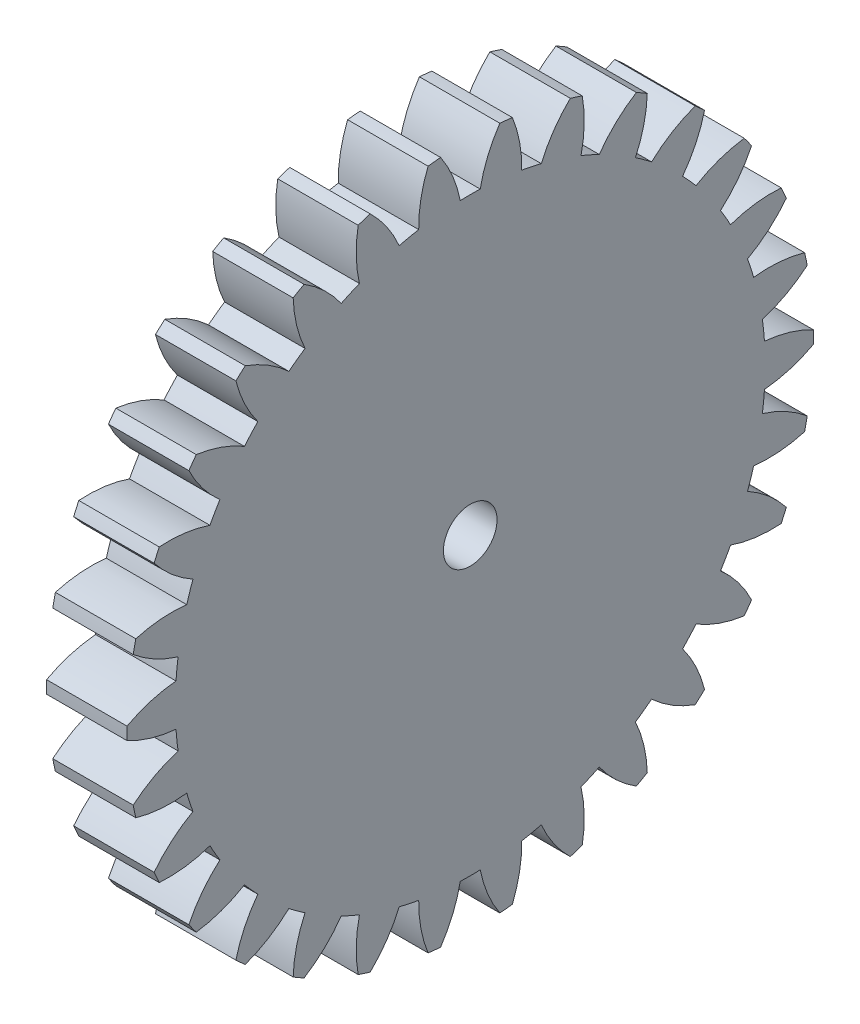
from build123d import *

# Parameters (mm, degrees)
BASPROSKE_W     = 3
BASPROSKE_H     = 12.8
TOOTHCUT_DEPTH  = 19.348841925
TEETHCUTS_COUNT = 30
TEETHCUTS_ANGLE = 348
BORSKE_R        = 1
BORE_DEPTH      = 50.0000508


with BuildPart() as part:
    # BasProSke → Base-Revolve (revolve)
    with BuildSketch(Plane(origin=(0, 0, 0), x_dir=(1, 0, 0), z_dir=(0, 1, 0)), mode=Mode.PRIVATE) as base_revolve_sk:
        with Locations((1.5, 6.4)):
            Rectangle(BASPROSKE_W, BASPROSKE_H)
    revolve(base_revolve_sk.sketch.rotate(Axis((-10, 0, 0), (1, 0, 0)), 180), axis=Axis((-10, 0, 0), (1, 0, 0)))

    # TooCutSke → ToothCut (cut, through all)
    with BuildSketch(Plane(origin=(0, 0, 0), x_dir=(0, 0, -1), z_dir=(1, 0, 0))):
        with BuildLine():
            ThreePointArc((0.37243947, 10.992692566), (0, 10.999), (-0.37243947, 10.992692566))
            ThreePointArc((-0.37243947, 10.992692566), (-0.655704499, 11.922595954), (-1.120515575, 12.776358245))
            ThreePointArc((-1.120515575, 12.776358245), (0, 12.8254), (1.120515575, 12.776358245))
            ThreePointArc((1.120515575, 12.776358245), (0.655704499, 11.922595954), (0.37243947, 10.992692566))
        make_face()
    toothcut = extrude(amount=TOOTHCUT_DEPTH, mode=Mode.SUBTRACT)

    # TeethCuts: ToothCut ×30 about axis
    teethcuts_axis = Axis((-10, 0, 0), (1, 0, 0))
    for i in range(1, TEETHCUTS_COUNT):
        add(toothcut.rotate(teethcuts_axis, i * TEETHCUTS_ANGLE / (TEETHCUTS_COUNT - 1)), mode=Mode.SUBTRACT)

    # BorSke → Bore (cut, symmetric)
    with BuildSketch(Plane(origin=(0, 0, 0), x_dir=(0, 0, -1), z_dir=(1, 0, 0))):
        with Locations(Location((0, 0, 0), (0, 0, 180))):
            Circle(BORSKE_R)
    extrude(amount=BORE_DEPTH, both=True, mode=Mode.SUBTRACT)


solid = part.part
